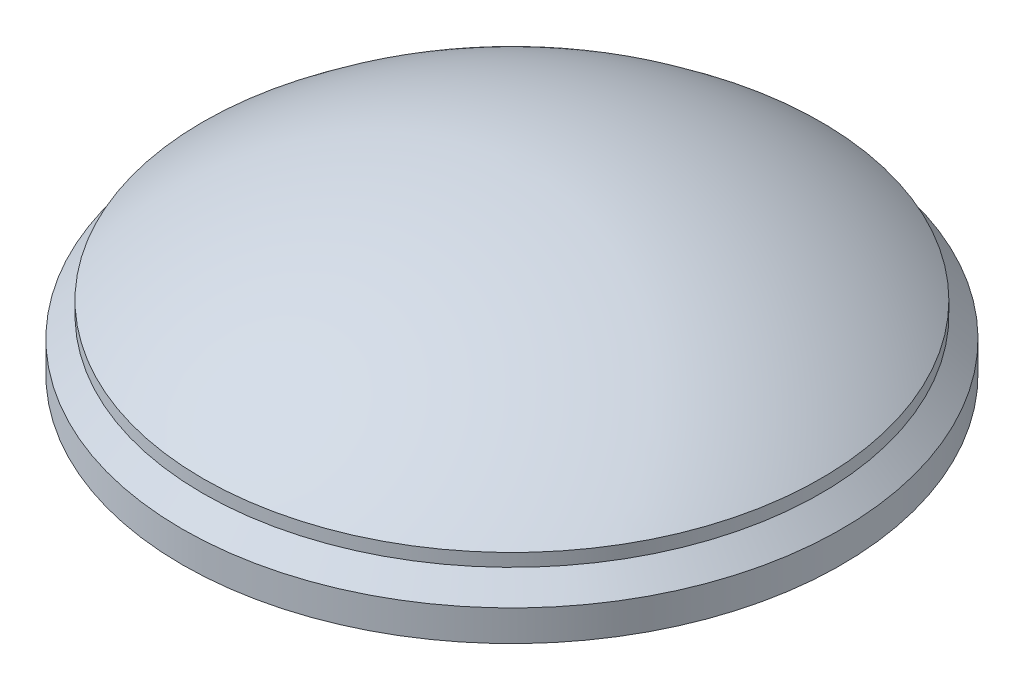
from build123d import *


with BuildPart() as part:
    # Sketch1 → Revolve1 (revolve)
    with BuildSketch(Plane.XY, mode=Mode.PRIVATE) as revolve1_sk:
        with BuildLine():
            Line((-64, 16), (-56, 16))
            Line((-56, 16), (-56, 18.790689802))
            ThreePointArc((-56, 18.790689802), (-29.913629212, 34.407796248), (0, 39.845400687))
            Line((0, 39.845400687), (0, 49.845400687))
            ThreePointArc((0, 49.845400687), (-31.841899011, 44.350112671), (-60, 28.5))
            Line((-60, 28.5), (-60, 26))
            Line((-60, 26), (-64, 22))
            Line((-64, 22), (-64, 16))
        make_face()
    revolve(revolve1_sk.sketch.rotate(Axis((0, 289.417577788, 0), (0, -1, 0)), 270), axis=Axis((0, 289.417577788, 0), (0, -1, 0)))


solid = part.part
